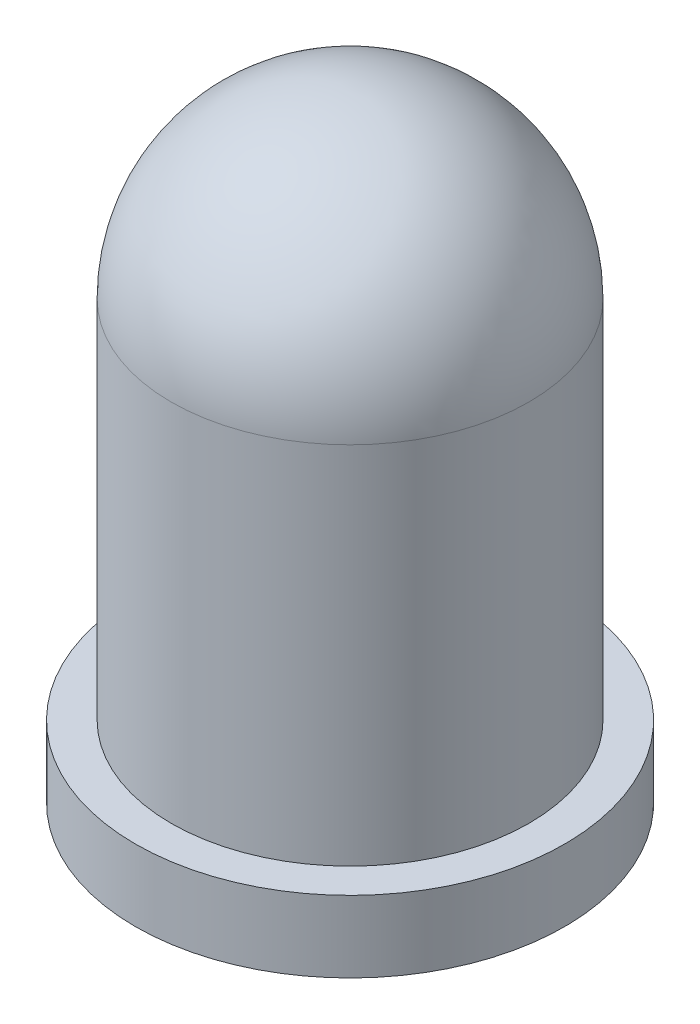
from build123d import *

# Parameters (mm, degrees)
SKETCH1_R           = 2.5
BOSS_EXTRUDE1_DEPTH = 8.6
SKETCH3_R           = 3
BOSS_EXTRUDE2_DEPTH = 1


with BuildPart() as part:
    # Sketch1 → Boss-Extrude1 (new body)
    with BuildSketch(Plane(origin=(0, 0, 0), x_dir=(1, 0, 0), z_dir=(0, 1, 0))):
        with Locations(Location((0, 0, 0), (0, 0, 90))):
            Circle(SKETCH1_R)
    extrude(amount=BOSS_EXTRUDE1_DEPTH)

    # Sketch2 → Cut-Revolve1 (revolve, cut)
    with BuildSketch(Plane.XY, mode=Mode.PRIVATE) as cut_revolve1_sk:
        with BuildLine():
            Line((-2.5, 6.1), (-3.705668916, 6.1))
            Line((-3.705668916, 6.1), (-3.705668916, 8.79154607))
            Line((-3.705668916, 8.79154607), (0, 8.79154607))
            Line((0, 8.79154607), (0, 8.6))
            ThreePointArc((0, 8.6), (-1.767766953, 7.867766953), (-2.5, 6.1))
        make_face()
    revolve(cut_revolve1_sk.sketch.rotate(Axis((0, 8.79154607, 0), (0, -1, 0)), 90), axis=Axis((0, 8.79154607, 0), (0, -1, 0)), mode=Mode.SUBTRACT)

    # Sketch3 → Boss-Extrude2 (add)
    with BuildSketch(Plane(origin=(0, 0, 0), x_dir=(1, 0, 0), z_dir=(0, 1, 0))):
        with Locations(Location((0, 0, 0), (0, 0, 270))):
            Circle(SKETCH3_R)
    extrude(amount=BOSS_EXTRUDE2_DEPTH)


solid = part.part
